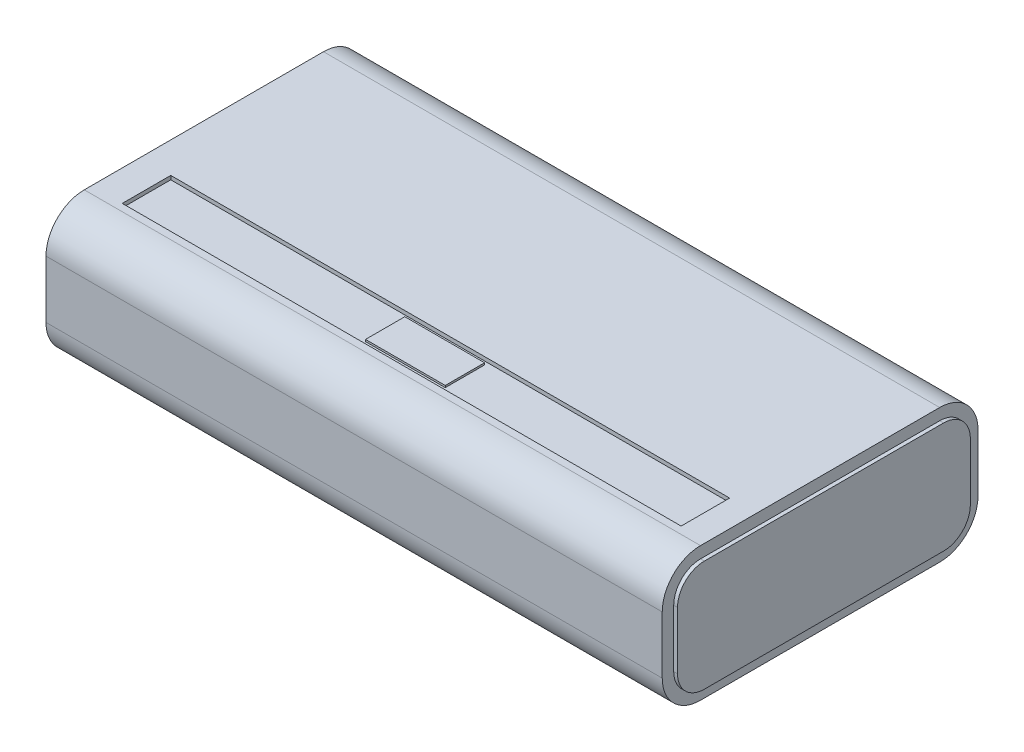
from build123d import *

# Parameters (mm, degrees)
SKETCH1_W           = 161
SKETCH1_H           = 82.5
BOSS_EXTRUDE1_DEPTH = 35
FILLET1_R           = 10
BOSS_EXTRUDE2_DEPTH = 1
BOSS_EXTRUDE3_START = 1
BOSS_EXTRUDE3_DEPTH = 1
SKETCH4_W           = 146.0174604
SKETCH4_H           = 12.670298151
CUT_EXTRUDE1_DEPTH  = 1
SKETCH6_W           = 20.834184422
SKETCH6_H           = 10.266465629
BOSS_EXTRUDE5_DEPTH = 0.5
SKETCH7_R           = 8.605932771
BOSS_EXTRUDE6_DEPTH = 0.5


with BuildPart() as part:
    # Sketch1 → Boss-Extrude1 (new body)
    with BuildSketch(Plane(origin=(0, 0, 0), x_dir=(1, 0, 0), z_dir=(0, 1, 0))):
        Rectangle(SKETCH1_W, SKETCH1_H)
    extrude(amount=BOSS_EXTRUDE1_DEPTH)

    # Fillet1
    fillet1_edges = [part.edges().sort_by_distance(p)[0] for p in [
        (0, 35, -41.25),
        (0, 0, -41.25),
        (0, 0, 41.25),
        (0, 35, 41.25),
    ]]
    fillet(fillet1_edges, radius=FILLET1_R)

    # Sketch2 → Boss-Extrude2 (add)
    with BuildSketch(Plane(origin=(80.5, 0, 0), x_dir=(0, 0, -1), z_dir=(1, 0, 0))):
        with BuildLine():
            Line((38.25, 10), (38.25, 25))
            ThreePointArc((38.25, 25), (36.199747468, 29.949747468), (31.25, 32))
            Line((31.25, 32), (-31.25, 32))
            ThreePointArc((-31.25, 32), (-36.199747468, 29.949747468), (-38.25, 25))
            Line((-38.25, 25), (-38.25, 10))
            ThreePointArc((-38.25, 10), (-36.199747468, 5.050252532), (-31.25, 3))
            Line((-31.25, 3), (31.25, 3))
            ThreePointArc((31.25, 3), (36.199747468, 5.050252532), (38.25, 10))
        make_face()
    extrude(amount=BOSS_EXTRUDE2_DEPTH)

    # Sketch3 → Boss-Extrude3 (add)
    with BuildSketch(Plane.ZY.offset(80.5).offset(BOSS_EXTRUDE3_START)):
        with BuildLine():
            Line((31.25, 32), (-31.25, 32))
            ThreePointArc((-31.25, 32), (-36.199747468, 29.949747468), (-38.25, 25))
            Line((-38.25, 25), (-38.25, 10))
            ThreePointArc((-38.25, 10), (-36.199747468, 5.050252532), (-31.25, 3))
            Line((-31.25, 3), (31.25, 3))
            ThreePointArc((31.25, 3), (36.199747468, 5.050252532), (38.25, 10))
            Line((38.25, 10), (38.25, 25))
            ThreePointArc((38.25, 25), (36.199747468, 29.949747468), (31.25, 32))
        make_face()
    extrude(amount=-BOSS_EXTRUDE3_DEPTH)

    # Sketch4 → Cut-Extrude1 (cut)
    with BuildSketch(Plane(origin=(0, 35, 0), x_dir=(1, 0, 0), z_dir=(0, 1, 0))):
        with Locations((0.540805409, -23.022858836)):
            Rectangle(SKETCH4_W, SKETCH4_H)
    extrude(amount=-CUT_EXTRUDE1_DEPTH, mode=Mode.SUBTRACT)

    # Sketch6 → Boss-Extrude5 (add)
    with BuildSketch(Plane(origin=(0, 34, 0), x_dir=(1, 0, 0), z_dir=(0, 1, 0))):
        with Locations((0, -22.722377564)):
            Rectangle(SKETCH6_W, SKETCH6_H)
    extrude(amount=BOSS_EXTRUDE5_DEPTH)

    # Sketch7 → Boss-Extrude6 (add)
    with BuildSketch(Plane.ZY.offset(81.5)):
        with Locations((0, 17.304485336)):
            Circle(SKETCH7_R)
    extrude(amount=BOSS_EXTRUDE6_DEPTH)


solid = part.part
